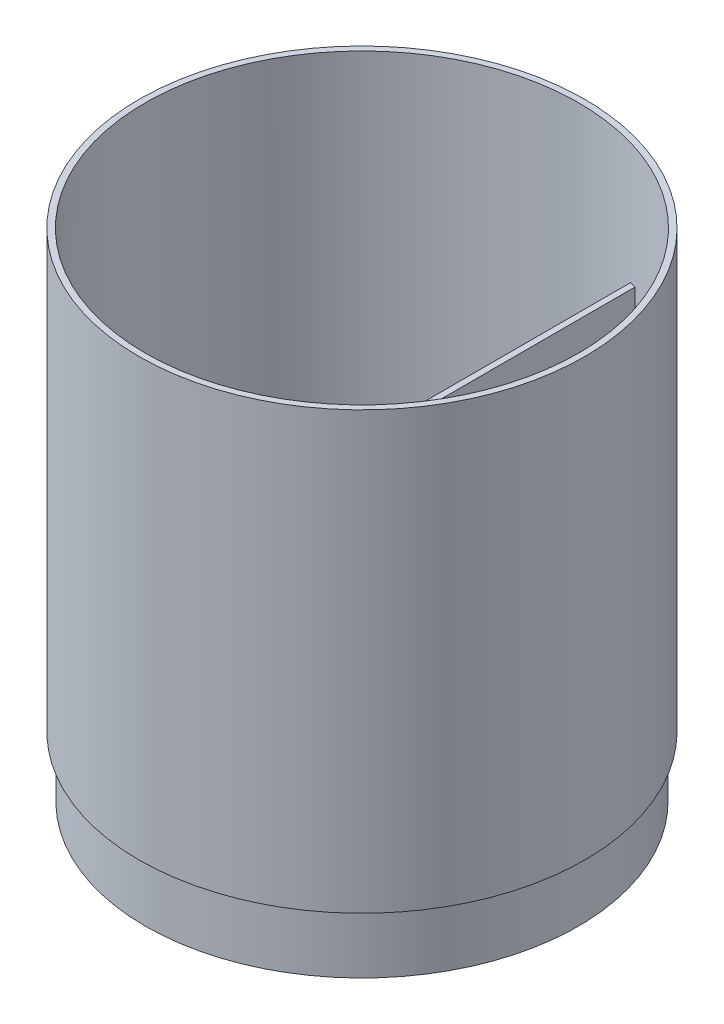
from build123d import *

# Parameters (mm, degrees)
SKETCH1_R           = 35.75
SKETCH1_R_2         = 34.75
BOSS_EXTRUDE1_DEPTH = 10
SKETCH2_R           = 36.8
SKETCH2_R_2         = 34.75
BOSS_EXTRUDE3_DEPTH = 2
SKETCH3_R           = 36.8
SKETCH3_R_2         = 35.8
BOSS_EXTRUDE4_DEPTH = 70
SKETCH4_W           = 1
SKETCH4_H           = 68.749981818
BOSS_EXTRUDE5_DEPTH = 50
SKETCH5_R           = 7.5
CUT_EXTRUDE1_DEPTH  = 10


with BuildPart() as part:
    # Sketch1 → Boss-Extrude1 (new body)
    with BuildSketch(Plane(origin=(0, 0, 0), x_dir=(1, 0, 0), z_dir=(0, 1, 0))):
        with Locations(Location((0, 0, 0), (0, 0, 270))):
            Circle(SKETCH1_R)
        with Locations(Location((0, 0, 0), (0, 0, 270))):
            Circle(SKETCH1_R_2, mode=Mode.SUBTRACT)
    extrude(amount=BOSS_EXTRUDE1_DEPTH)

    # Sketch2 → Boss-Extrude3 (add)
    with BuildSketch(Plane(origin=(0, 10, 0), x_dir=(1, 0, 0), z_dir=(0, 1, 0))):
        with Locations(Location((0, 0, 0), (0, 0, 270))):
            Circle(SKETCH2_R)
        with Locations(Location((0, 0, 0), (0, 0, 270))):
            Circle(SKETCH2_R_2, mode=Mode.SUBTRACT)
    extrude(amount=BOSS_EXTRUDE3_DEPTH)

    # Sketch3 → Boss-Extrude4 (add)
    with BuildSketch(Plane(origin=(0, 12, 0), x_dir=(1, 0, 0), z_dir=(0, 1, 0))):
        with Locations(Location((0, 0, 0), (0, 0, 270))):
            Circle(SKETCH3_R)
        with Locations(Location((0, 0, 0), (0, 0, 270))):
            Circle(SKETCH3_R_2, mode=Mode.SUBTRACT)
    extrude(amount=BOSS_EXTRUDE4_DEPTH)

    # Sketch4 → Boss-Extrude5 (add)
    with BuildSketch(Plane(origin=(0, 12, 0), x_dir=(1, 0, 0), z_dir=(0, 1, 0))):
        with Locations((10.5, 0)):
            Rectangle(SKETCH4_W, SKETCH4_H)
    extrude(amount=BOSS_EXTRUDE5_DEPTH)

    # Sketch5 → Cut-Extrude1 (cut)
    with BuildSketch(Plane.ZY.offset(36.8)):
        with Locations((0, 20)):
            Circle(SKETCH5_R)
    extrude(amount=-CUT_EXTRUDE1_DEPTH, mode=Mode.SUBTRACT)


solid = part.part
